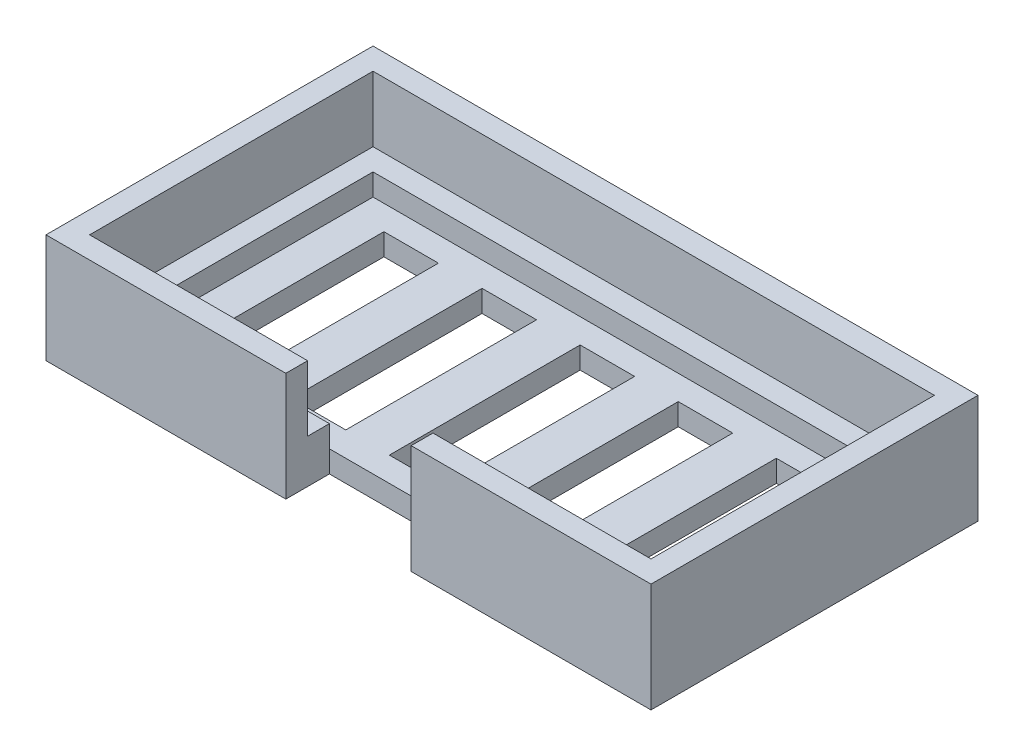
from build123d import *

# Parameters (mm, degrees)
BOSS_EXTRUDE1_DEPTH = 4
BOSS_EXTRUDE3_DEPTH = 10
BOSS_EXTRUDE4_DEPTH = 2
SKETCH2_W           = 5
SKETCH2_H           = 17.5
CUT_EXTRUDE2_DEPTH  = 2


with BuildPart() as part:
    # Sketch1 → Boss-Extrude1 (new body)
    with BuildSketch(Plane(origin=(0, 0, 0), x_dir=(1, 0, 0), z_dir=(0, 1, 0))):
        Polygon((5.75, -11), (5.75, -13), (25.75, -13), (25.75, 13), (-25.75, 13), (-25.75, -13), (-5.75, -13), (-5.75, -11), (-23.75, -11), (-23.75, 11), (23.75, 11), (23.75, -11), align=None)
    extrude(amount=BOSS_EXTRUDE1_DEPTH)

    # Sketch1<4> → Boss-Extrude3 (add)
    with BuildSketch(Plane(origin=(0, 0, 0), x_dir=(1, 0, 0), z_dir=(0, 1, 0))):
        Polygon((27.75, -15), (27.75, 15), (-27.75, 15), (-27.75, -15), (-5.75, -15), (-5.75, -13), (-25.75, -13), (-25.75, 13), (25.75, 13), (25.75, -13), (5.75, -13), (5.75, -15), align=None)
    extrude(amount=BOSS_EXTRUDE3_DEPTH)

    # Sketch1<6> → Boss-Extrude4 (add)
    with BuildSketch(Plane(origin=(0, 0, 0), x_dir=(1, 0, 0), z_dir=(0, 1, 0))):
        Polygon((-5.75, -11), (5.75, -11), (23.75, -11), (23.75, 11), (-23.75, 11), (-23.75, -11), align=None)
    extrude(amount=BOSS_EXTRUDE4_DEPTH)

    # Sketch2 → Cut-Extrude2 (cut)
    with BuildSketch(Plane(origin=(0, 2, 0), x_dir=(1, 0, 0), z_dir=(0, 1, 0))):
        with Locations((9, 0)):
            Rectangle(SKETCH2_W, SKETCH2_H)
        Rectangle(SKETCH2_W, SKETCH2_H)
        with Locations((18, 0)):
            Rectangle(SKETCH2_W, SKETCH2_H)
        with Locations((-9, 0)):
            Rectangle(SKETCH2_W, SKETCH2_H)
        with Locations((-18, 0)):
            Rectangle(SKETCH2_W, SKETCH2_H)
    extrude(amount=-CUT_EXTRUDE2_DEPTH, mode=Mode.SUBTRACT)


solid = part.part
